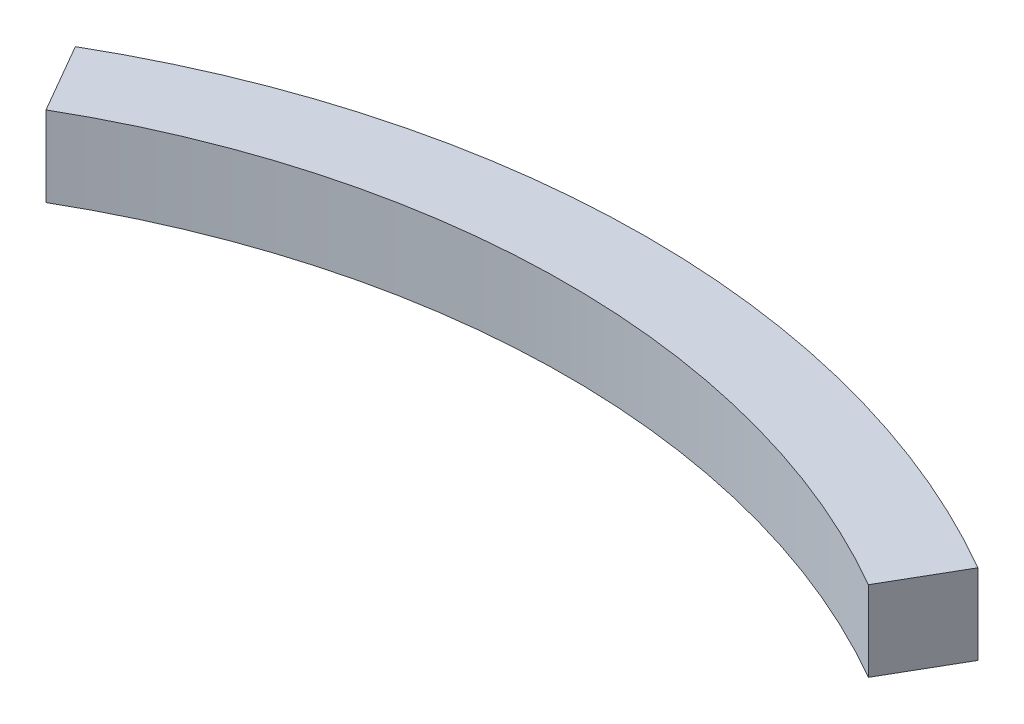
from build123d import *

# Parameters (mm, degrees)
EXTRUDE_1_DEPTH = 1


with BuildPart() as part:
    # Эскиз1 → Вытянуть1 (new body)
    with BuildSketch(Plane(origin=(0, 0, 0), x_dir=(1, 0, 0), z_dir=(0, 1, 0))):
        with BuildLine():
            Line((5.125, 8.876760389), (5.625, 9.742785793))
            ThreePointArc((5.625, 9.742785793), (0, 11.25), (-5.625, 9.742785793))
            Line((-5.625, 9.742785793), (-5.125, 8.876760389))
            ThreePointArc((-5.125, 8.876760389), (0, 10.25), (5.125, 8.876760389))
        make_face()
    extrude(amount=EXTRUDE_1_DEPTH)


solid = part.part
